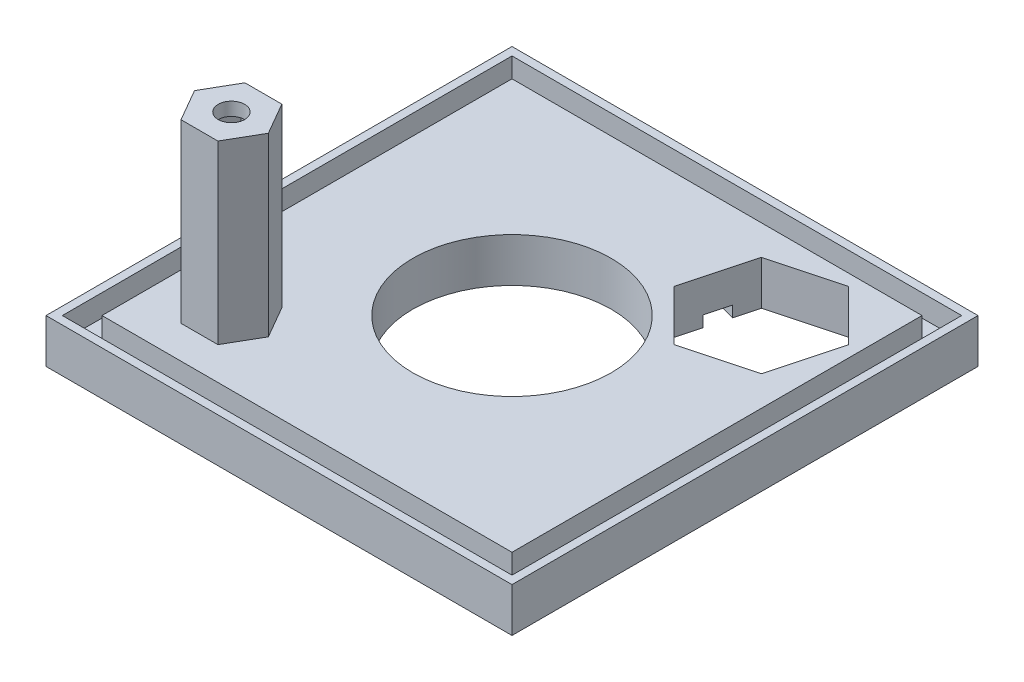
from build123d import *

# Parameters (mm, degrees)
SKETCH1_W           = 105.7
SKETCH1_H           = 105.7
SKETCH1_R           = 22.5
BOSS_EXTRUDE1_DEPTH = 10
SKETCH3_W           = 102
SKETCH3_H           = 102
SKETCH3_W_2         = 93
SKETCH3_H_2         = 93
CUT_EXTRUDE1_DEPTH  = 5
SKETCH8_R           = 3
CUT_EXTRUDE5_DEPTH  = 76.407194617
SKETCH4_R           = 10.375
CUT_EXTRUDE7_DEPTH  = 76.407194617
CUT_EXTRUDE11_DEPTH = 76.407194617
BOSS_EXTRUDE5_START = -40
SKETCH9_R           = 3
BOSS_EXTRUDE5_DEPTH = 40
CUT_EXTRUDE12_DEPTH = 47
CUT_EXTRUDE13_DEPTH = 2.5


with BuildPart() as part:
    # Sketch1 → Boss-Extrude1 (new body)
    with BuildSketch(Plane(origin=(0, 0, 0), x_dir=(1, 0, 0), z_dir=(0, 1, 0))):
        Rectangle(SKETCH1_W, SKETCH1_H)
        with Locations(Location((0, 0, 0), (0, 0, 270))):
            Circle(SKETCH1_R, mode=Mode.SUBTRACT)
    extrude(amount=BOSS_EXTRUDE1_DEPTH)

    # Sketch3 → Cut-Extrude1 (cut)
    with BuildSketch(Plane(origin=(0, 10, 0), x_dir=(1, 0, 0), z_dir=(0, 1, 0))):
        Rectangle(SKETCH3_W, SKETCH3_H)
        Rectangle(SKETCH3_W_2, SKETCH3_H_2, mode=Mode.SUBTRACT)
    extrude(amount=-CUT_EXTRUDE1_DEPTH, mode=Mode.SUBTRACT)

    # Sketch8 → Cut-Extrude5 (cut, through all)
    with BuildSketch(Plane.XZ.offset(-10)):
        with Locations(Location((-31.819805153, 31.819805153, 0), (0, 0, 270))):
            Circle(SKETCH8_R)
    extrude(amount=CUT_EXTRUDE5_DEPTH, mode=Mode.SUBTRACT)

    # Sketch4 → Cut-Extrude7 (cut, through all)
    with BuildSketch(Plane(origin=(0, 10, 0), x_dir=(1, 0, 0), z_dir=(0, 1, 0))):
        with Locations(Location((28.284271247, 28.284271247, 0), (0, 0, 270))):
            Circle(SKETCH4_R)
    extrude(amount=-CUT_EXTRUDE7_DEPTH, mode=Mode.SUBTRACT)

    # Sketch12 → Cut-Extrude11 (cut, through all)
    with BuildSketch(Plane.XZ):
        Polygon((43.899242251, -32.468290118), (39.71522338, -16.853319114), (24.100252377, -12.669300244), (12.669300244, -24.100252377), (16.853319114, -39.71522338), (32.468290118, -43.899242251), align=None)
    extrude(amount=-CUT_EXTRUDE11_DEPTH, mode=Mode.SUBTRACT)

    # Sketch9 → Boss-Extrude5 (add)
    with BuildSketch(Plane.XZ.offset(-10).offset(BOSS_EXTRUDE5_START)):
        Polygon((-23.44822625, 31.819805153), (-27.634015702, 39.069805153), (-36.005594605, 39.069805153), (-40.191384057, 31.819805153), (-36.005594605, 24.569805153), (-27.634015702, 24.569805153), align=None)
        with Locations(Location((-31.819805153, 31.819805153, 0), (0, 0, 270))):
            Circle(SKETCH9_R, mode=Mode.SUBTRACT)
    extrude(amount=BOSS_EXTRUDE5_DEPTH)

    # Sketch16 → Cut-Extrude12 (cut)
    with BuildSketch(Plane.XZ):
        Polygon((-25.757627327, 31.819805153), (-28.78871624, 37.069805153), (-34.850894067, 37.069805153), (-37.88198298, 31.819805153), (-34.850894067, 26.569805153), (-28.78871624, 26.569805153), align=None)
    extrude(amount=-CUT_EXTRUDE12_DEPTH, mode=Mode.SUBTRACT)

    # Sketch17 → Cut-Extrude13 (cut)
    with BuildSketch(Plane.XZ):
        Polygon((29.251441857, -14.049557305), (30.092603753, -10.91029837), (35.405195798, -12.333803118), (34.564033901, -15.473062053), align=None)
        Polygon((36.239222536, -40.128309832), (40.128309832, -36.239222536), (42.426406871, -38.537319575), (38.537319575, -42.426406871), align=None)
        Polygon((14.049557305, -29.251441857), (15.473062053, -34.564033901), (12.333803118, -35.405195798), (10.91029837, -30.092603753), align=None)
    extrude(amount=-CUT_EXTRUDE13_DEPTH, mode=Mode.SUBTRACT)


solid = part.part
